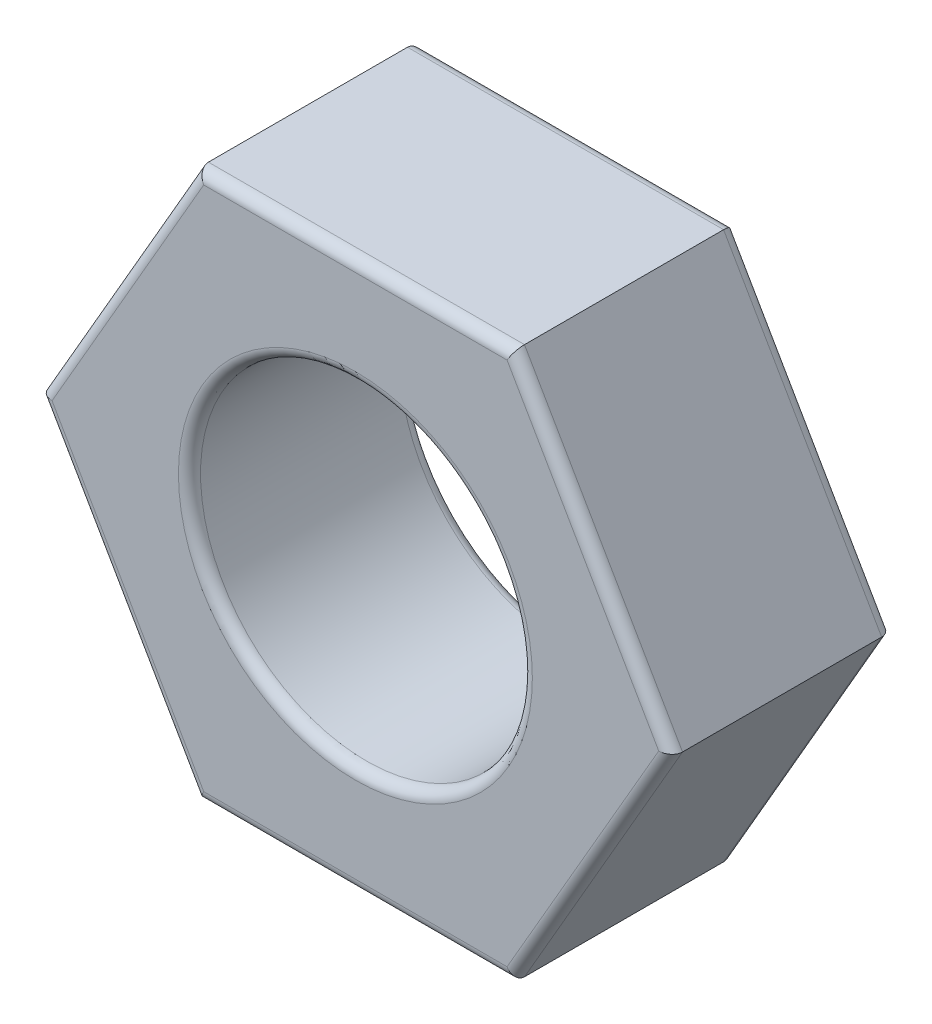
from build123d import *

# Parameters (mm, degrees)
SKETCH1_R      = 3
EXTRUDE1_DEPTH = 4
FILLET1_R      = 0.2


with BuildPart() as part:
    # Sketch1 → Extrude1 (new body)
    with BuildSketch(Plane.XY):
        Polygon((2.857883832, 4.95), (-2.857883832, 4.95), (-5.715767665, 0), (-2.857883832, -4.95), (2.857883832, -4.95), (5.715767665, 0), align=None)
        Circle(SKETCH1_R, mode=Mode.SUBTRACT)
    extrude(amount=EXTRUDE1_DEPTH)

    # Fillet1
    fillet1_edges = [part.edges().sort_by_distance(p)[0] for p in [
        (-4.286825749, 2.475, 4),
        (-4.286825749, -2.475, 4),
        (-3, 0, 0),
        (0, -4.95, 4),
        (-3, 0, 4),
        (4.286825749, -2.475, 4),
        (4.286825749, 2.475, 4),
        (4.286825749, -2.475, 0),
        (0, -4.95, 0),
        (-4.286825749, -2.475, 0),
        (-4.286825749, 2.475, 0),
        (0, 4.95, 4),
        (0, 4.95, 0),
        (4.286825749, 2.475, 0),
    ]]
    fillet(fillet1_edges, radius=FILLET1_R)


solid = part.part
